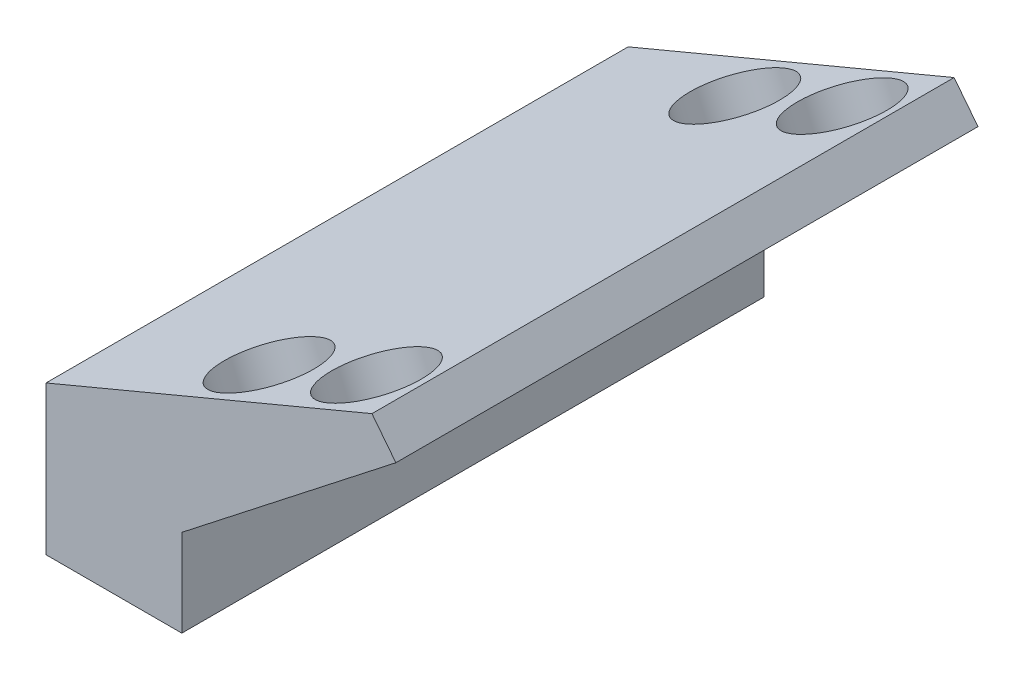
from build123d import *

# Parameters (mm, degrees)
EXTRUDE_1_DEPTH     = 30
SKETCH_3_R          = 2.5
CUT_EXTRUDE_1_DEPTH = 25


with BuildPart() as part:
    # 草图1 → 凸台-拉伸1 (new body)
    with BuildSketch(Plane.XY):
        Polygon((0, 0), (7, 0), (7, 4.5), (18.030345735, 13.121570214), (16.798692847, 14.697333891), (0, 7.668265774), align=None)
    extrude(amount=EXTRUDE_1_DEPTH)

    # 草图3 → 切除-拉伸1 (cut)
    with BuildSketch(Plane(origin=(-2.730554157, 6.52572145, 0), x_dir=(0.9224985403902117, 0.386000573805181, 0), z_dir=(-0.386000573805181, 0.9224985403902117, 0))):
        with Locations(Location((18.169948947, -3, 0), (0, 0, 180))):
            Circle(SKETCH_3_R)
        with Locations(Location((12.169948947, -3, 0), (0, 0, 180))):
            Circle(SKETCH_3_R)
        with Locations(Location((18.169948947, -27, 0), (0, 0, 180))):
            Circle(SKETCH_3_R)
        with Locations(Location((12.169948947, -27, 0), (0, 0, 180))):
            Circle(SKETCH_3_R)
    extrude(amount=-CUT_EXTRUDE_1_DEPTH, mode=Mode.SUBTRACT)


solid = part.part
